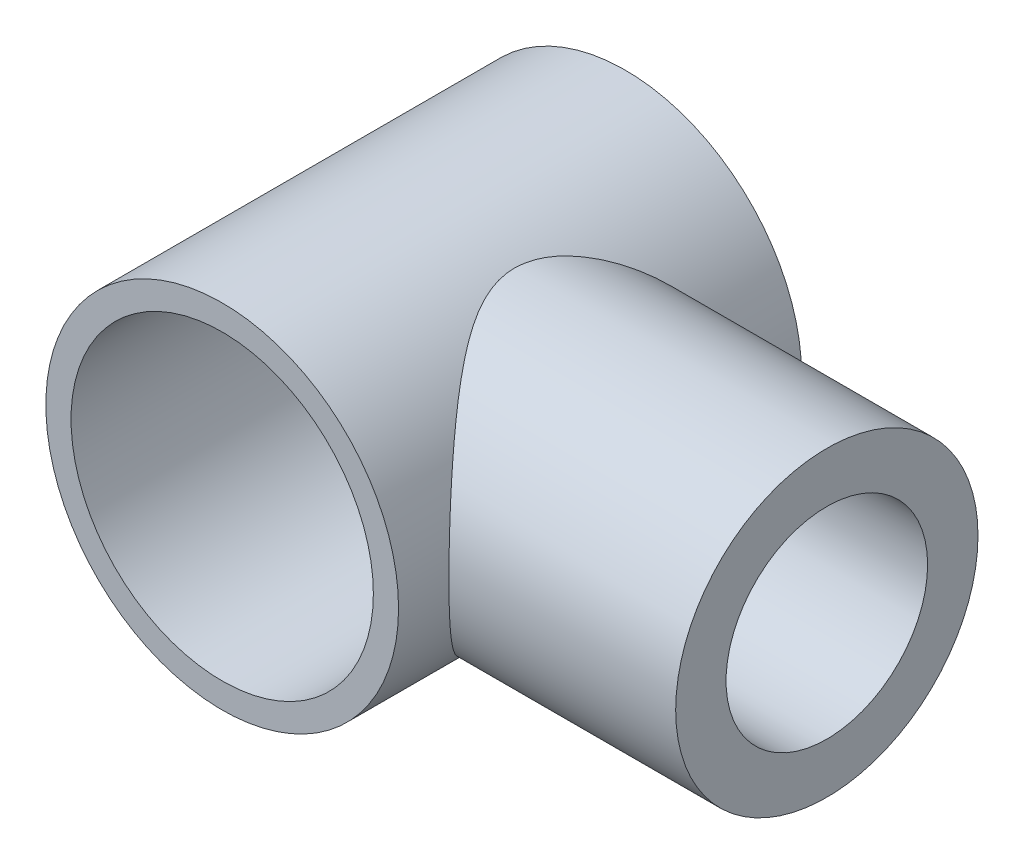
from build123d import *

# Parameters (mm, degrees)
SKETCH1_R           = 19.05
SKETCH1_R_2         = 12.7
BOSS_EXTRUDE1_DEPTH = 50.8
SKETCH2_R           = 22.225
SKETCH2_R_2         = 19.05
BOSS_EXTRUDE2_DEPTH = 25.4
CUT_EXTRUDE1_START  = -50.8
SKETCH3_R           = 19.05
CUT_EXTRUDE1_DEPTH  = 50.8
CUT_EXTRUDE2_START  = -50.8
SKETCH4_R           = 12.7
CUT_EXTRUDE2_DEPTH  = 50.8


with BuildPart() as part:
    # Sketch1 → Boss-Extrude1 (new body)
    with BuildSketch(Plane.YZ):
        with Locations(Location((0, 0, 0), (0, 0, 270))):
            Circle(SKETCH1_R)
        with Locations(Location((0, 0, 0), (0, 0, 270))):
            Circle(SKETCH1_R_2, mode=Mode.SUBTRACT)
    extrude(amount=BOSS_EXTRUDE1_DEPTH)

    # Sketch2 → Boss-Extrude2 (add, symmetric)
    with BuildSketch(Plane(origin=(0, 0, 0), x_dir=(0, 1, 0), z_dir=(0, 0, 1))):
        with Locations(Location((0, 0, 0), (0, 0, 270))):
            Circle(SKETCH2_R)
        with Locations(Location((0, 0, 0), (0, 0, 270))):
            Circle(SKETCH2_R_2, mode=Mode.SUBTRACT)
    extrude(amount=BOSS_EXTRUDE2_DEPTH, both=True)

    # Sketch3 → Cut-Extrude1 (cut)
    with BuildSketch(Plane.XY.offset(25.4).offset(CUT_EXTRUDE1_START)):
        Circle(SKETCH3_R)
    extrude(amount=CUT_EXTRUDE1_DEPTH, mode=Mode.SUBTRACT)

    # Sketch4 → Cut-Extrude2 (cut)
    with BuildSketch(Plane.YZ.offset(50.8).offset(CUT_EXTRUDE2_START)):
        with Locations(Location((0, 0, 0), (0, 0, 270))):
            Circle(SKETCH4_R)
    extrude(amount=CUT_EXTRUDE2_DEPTH, mode=Mode.SUBTRACT)


solid = part.part
